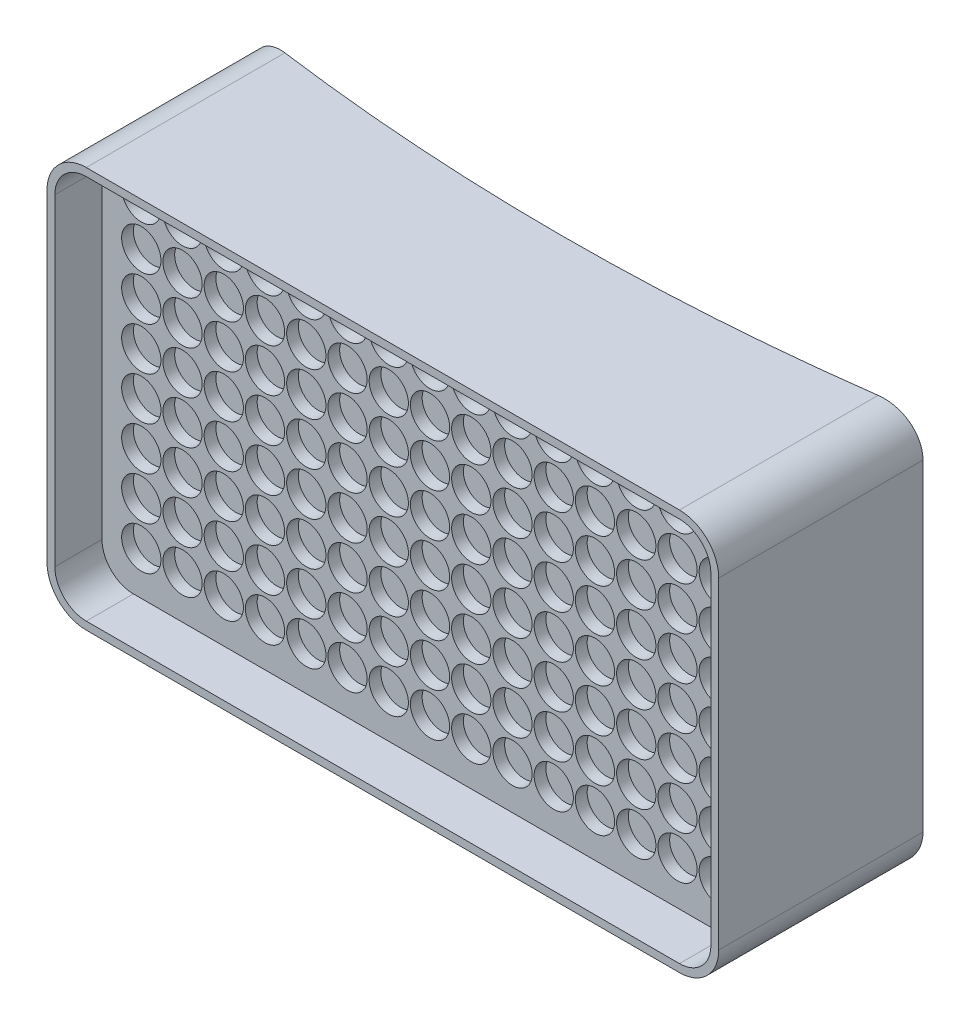
from build123d import *

# Parameters (mm, degrees)
SKETCH1_W               = 171
SKETCH1_H               = 102
BOSS_EXTRUDE1_DEPTH     = 40
FILLET1_R               = 10
SKETCH3_R               = 5
CUT_EXTRUDE1_DEPTH      = 3
BOSS_EXTRUDE4_START     = 12
BOSS_EXTRUDE4_DEPTH     = 12
CUT_EXTRUDE2_DEPTH      = 113.317629961
CUT_EXTRUDE2_DEPTH_BACK = 113.317629961
SKETCH6_R               = 565


with BuildPart() as part:
    # Sketch1 → Boss-Extrude1 (new body)
    with BuildSketch(Plane.XY):
        Rectangle(SKETCH1_W, SKETCH1_H)
    extrude(amount=BOSS_EXTRUDE1_DEPTH)

    # Fillet1
    fillet1_edges = [part.edges().sort_by_distance(p)[0] for p in [
        (-85.5, 51, 20),
        (85.5, 51, 20),
        (85.5, -51, 20),
        (-85.5, -51, 20),
    ]]
    fillet(fillet1_edges, radius=FILLET1_R)

    # Sketch3 → Cut-Extrude1 (cut)
    with BuildSketch(Plane.XY.offset(40)):
        with Locations((-73.5, 39)):
            Circle(SKETCH3_R)
        with Locations((-63, 39)):
            Circle(SKETCH3_R)
        with Locations((-52.5, 39)):
            Circle(SKETCH3_R)
        with Locations((-42, 39)):
            Circle(SKETCH3_R)
        with Locations((-31.5, 39)):
            Circle(SKETCH3_R)
        with Locations((-21, 39)):
            Circle(SKETCH3_R)
        with Locations((-10.5, 39)):
            Circle(SKETCH3_R)
        with Locations((0, 39)):
            Circle(SKETCH3_R)
        with Locations((10.5, 39)):
            Circle(SKETCH3_R)
        with Locations((21, 39)):
            Circle(SKETCH3_R)
        with Locations((31.5, 39)):
            Circle(SKETCH3_R)
        with Locations((42, 39)):
            Circle(SKETCH3_R)
        with Locations((52.5, 39)):
            Circle(SKETCH3_R)
        with Locations((63, 39)):
            Circle(SKETCH3_R)
        with Locations((73.5, 39)):
            Circle(SKETCH3_R)
        with Locations((-63, 28)):
            Circle(SKETCH3_R)
        with Locations((-52.5, 28)):
            Circle(SKETCH3_R)
        with Locations((-42, 28)):
            Circle(SKETCH3_R)
        with Locations((-31.5, 28)):
            Circle(SKETCH3_R)
        with Locations((-21, 28)):
            Circle(SKETCH3_R)
        with Locations((-10.5, 28)):
            Circle(SKETCH3_R)
        with Locations((0, 28)):
            Circle(SKETCH3_R)
        with Locations((10.5, 28)):
            Circle(SKETCH3_R)
        with Locations((21, 28)):
            Circle(SKETCH3_R)
        with Locations((31.5, 28)):
            Circle(SKETCH3_R)
        with Locations((42, 28)):
            Circle(SKETCH3_R)
        with Locations((52.5, 28)):
            Circle(SKETCH3_R)
        with Locations((63, 28)):
            Circle(SKETCH3_R)
        with Locations((73.5, 28)):
            Circle(SKETCH3_R)
        with Locations((-63, 17)):
            Circle(SKETCH3_R)
        with Locations((-52.5, 17)):
            Circle(SKETCH3_R)
        with Locations((-42, 17)):
            Circle(SKETCH3_R)
        with Locations((-31.5, 17)):
            Circle(SKETCH3_R)
        with Locations((-21, 17)):
            Circle(SKETCH3_R)
        with Locations((-10.5, 17)):
            Circle(SKETCH3_R)
        with Locations((0, 17)):
            Circle(SKETCH3_R)
        with Locations((10.5, 17)):
            Circle(SKETCH3_R)
        with Locations((21, 17)):
            Circle(SKETCH3_R)
        with Locations((31.5, 17)):
            Circle(SKETCH3_R)
        with Locations((42, 17)):
            Circle(SKETCH3_R)
        with Locations((52.5, 17)):
            Circle(SKETCH3_R)
        with Locations((63, 17)):
            Circle(SKETCH3_R)
        with Locations((73.5, 17)):
            Circle(SKETCH3_R)
        with Locations((-63, 6)):
            Circle(SKETCH3_R)
        with Locations((-52.5, 6)):
            Circle(SKETCH3_R)
        with Locations((-42, 6)):
            Circle(SKETCH3_R)
        with Locations((-31.5, 6)):
            Circle(SKETCH3_R)
        with Locations((-21, 6)):
            Circle(SKETCH3_R)
        with Locations((-10.5, 6)):
            Circle(SKETCH3_R)
        with Locations((0, 6)):
            Circle(SKETCH3_R)
        with Locations((10.5, 6)):
            Circle(SKETCH3_R)
        with Locations((21, 6)):
            Circle(SKETCH3_R)
        with Locations((31.5, 6)):
            Circle(SKETCH3_R)
        with Locations((42, 6)):
            Circle(SKETCH3_R)
        with Locations((52.5, 6)):
            Circle(SKETCH3_R)
        with Locations((63, 6)):
            Circle(SKETCH3_R)
        with Locations((73.5, 6)):
            Circle(SKETCH3_R)
        with Locations((-63, -5)):
            Circle(SKETCH3_R)
        with Locations((-52.5, -5)):
            Circle(SKETCH3_R)
        with Locations((-42, -5)):
            Circle(SKETCH3_R)
        with Locations((-31.5, -5)):
            Circle(SKETCH3_R)
        with Locations((-21, -5)):
            Circle(SKETCH3_R)
        with Locations((-10.5, -5)):
            Circle(SKETCH3_R)
        with Locations((0, -5)):
            Circle(SKETCH3_R)
        with Locations((10.5, -5)):
            Circle(SKETCH3_R)
        with Locations((21, -5)):
            Circle(SKETCH3_R)
        with Locations((31.5, -5)):
            Circle(SKETCH3_R)
        with Locations((42, -5)):
            Circle(SKETCH3_R)
        with Locations((52.5, -5)):
            Circle(SKETCH3_R)
        with Locations((63, -5)):
            Circle(SKETCH3_R)
        with Locations((73.5, -5)):
            Circle(SKETCH3_R)
        with Locations((-63, -16)):
            Circle(SKETCH3_R)
        with Locations((-52.5, -16)):
            Circle(SKETCH3_R)
        with Locations((-42, -16)):
            Circle(SKETCH3_R)
        with Locations((-31.5, -16)):
            Circle(SKETCH3_R)
        with Locations((-21, -16)):
            Circle(SKETCH3_R)
        with Locations((-10.5, -16)):
            Circle(SKETCH3_R)
        with Locations((0, -16)):
            Circle(SKETCH3_R)
        with Locations((10.5, -16)):
            Circle(SKETCH3_R)
        with Locations((21, -16)):
            Circle(SKETCH3_R)
        with Locations((31.5, -16)):
            Circle(SKETCH3_R)
        with Locations((42, -16)):
            Circle(SKETCH3_R)
        with Locations((52.5, -16)):
            Circle(SKETCH3_R)
        with Locations((63, -16)):
            Circle(SKETCH3_R)
        with Locations((73.5, -16)):
            Circle(SKETCH3_R)
        with Locations((-63, -27)):
            Circle(SKETCH3_R)
        with Locations((-52.5, -27)):
            Circle(SKETCH3_R)
        with Locations((-42, -27)):
            Circle(SKETCH3_R)
        with Locations((-31.5, -27)):
            Circle(SKETCH3_R)
        with Locations((-21, -27)):
            Circle(SKETCH3_R)
        with Locations((-10.5, -27)):
            Circle(SKETCH3_R)
        with Locations((0, -27)):
            Circle(SKETCH3_R)
        with Locations((10.5, -27)):
            Circle(SKETCH3_R)
        with Locations((21, -27)):
            Circle(SKETCH3_R)
        with Locations((31.5, -27)):
            Circle(SKETCH3_R)
        with Locations((42, -27)):
            Circle(SKETCH3_R)
        with Locations((52.5, -27)):
            Circle(SKETCH3_R)
        with Locations((63, -27)):
            Circle(SKETCH3_R)
        with Locations((73.5, -27)):
            Circle(SKETCH3_R)
        with Locations((-63, -38)):
            Circle(SKETCH3_R)
        with Locations((-52.5, -38)):
            Circle(SKETCH3_R)
        with Locations((-42, -38)):
            Circle(SKETCH3_R)
        with Locations((-31.5, -38)):
            Circle(SKETCH3_R)
        with Locations((-21, -38)):
            Circle(SKETCH3_R)
        with Locations((-10.5, -38)):
            Circle(SKETCH3_R)
        with Locations((0, -38)):
            Circle(SKETCH3_R)
        with Locations((10.5, -38)):
            Circle(SKETCH3_R)
        with Locations((21, -38)):
            Circle(SKETCH3_R)
        with Locations((31.5, -38)):
            Circle(SKETCH3_R)
        with Locations((42, -38)):
            Circle(SKETCH3_R)
        with Locations((52.5, -38)):
            Circle(SKETCH3_R)
        with Locations((63, -38)):
            Circle(SKETCH3_R)
        with Locations((73.5, -38)):
            Circle(SKETCH3_R)
        with Locations((-73.5, 28)):
            Circle(SKETCH3_R)
        with Locations((-73.5, 17)):
            Circle(SKETCH3_R)
        with Locations((-73.5, 6)):
            Circle(SKETCH3_R)
        with Locations((-73.5, -5)):
            Circle(SKETCH3_R)
        with Locations((-73.5, -16)):
            Circle(SKETCH3_R)
        with Locations((-73.5, -27)):
            Circle(SKETCH3_R)
        with Locations((-73.5, -38)):
            Circle(SKETCH3_R)
    extrude(amount=-CUT_EXTRUDE1_DEPTH, mode=Mode.SUBTRACT)

    # Sketch5 → Boss-Extrude4 (add)
    with BuildSketch(Plane.XY.offset(40).offset(BOSS_EXTRUDE4_START)):
        with BuildLine():
            Line((-75.5, 51), (75.5, 51))
            ThreePointArc((75.5, 51), (82.571067812, 48.071067812), (85.5, 41))
            Line((85.5, 41), (85.5, -41))
            ThreePointArc((85.5, -41), (82.571067812, -48.071067812), (75.5, -51))
            Line((75.5, -51), (-75.5, -51))
            ThreePointArc((-75.5, -51), (-82.571067812, -48.071067812), (-85.5, -41))
            Line((-85.5, -41), (-85.5, 41))
            ThreePointArc((-85.5, 41), (-82.571067812, 48.071067812), (-75.5, 51))
        make_face()
        with BuildLine():
            Line((-75.5, 49), (75.5, 49))
            ThreePointArc((75.5, 49), (81.156854249, 46.656854249), (83.5, 41))
            Line((83.5, 41), (83.5, -41))
            ThreePointArc((83.5, -41), (81.156854249, -46.656854249), (75.5, -49))
            Line((75.5, -49), (-75.5, -49))
            ThreePointArc((-75.5, -49), (-81.156854249, -46.656854249), (-83.5, -41))
            Line((-83.5, -41), (-83.5, 41))
            ThreePointArc((-83.5, 41), (-81.156854249, 46.656854249), (-75.5, 49))
        make_face(mode=Mode.SUBTRACT)
    extrude(amount=-BOSS_EXTRUDE4_DEPTH)

    # Sketch6 → Cut-Extrude2 (cut, two sides: drawn at the far end of the back side and taken through both)
    with BuildSketch(Plane(origin=(0, 0, 0), x_dir=(1, 0, 0), z_dir=(0, 1, 0)).offset(-CUT_EXTRUDE2_DEPTH_BACK)):
        with Locations((0, 558.493285546)):
            Circle(SKETCH6_R)
    extrude(amount=CUT_EXTRUDE2_DEPTH + CUT_EXTRUDE2_DEPTH_BACK, mode=Mode.SUBTRACT)


solid = part.part
